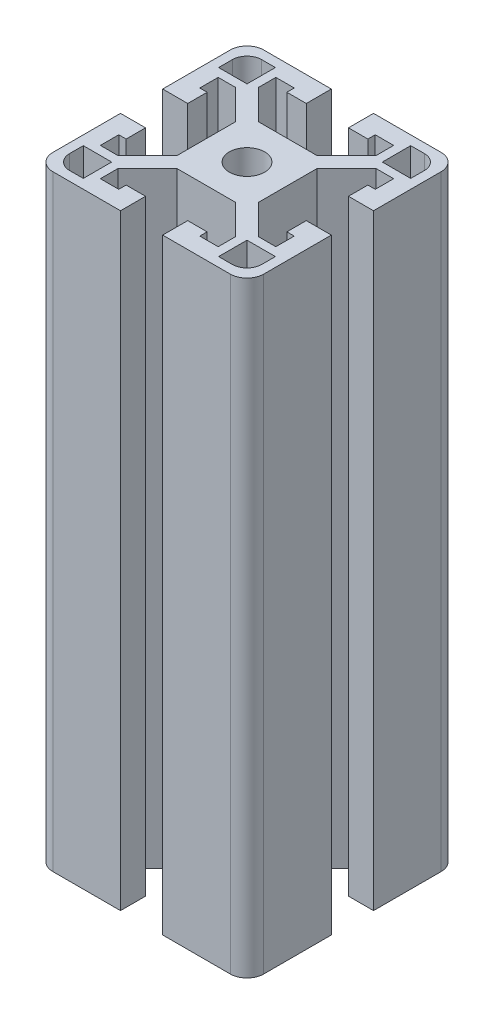
from build123d import *

# Parameters (mm, degrees)
SKETCH2_R                            = 3.35
F_40_SERIES_TS40_40LM_650033_2_DEPTH = 115
M8X1_25_TAPPED_HOLE3_D               = 6.8
M8X1_25_TAPPED_HOLE3_DEPTH           = 25
M8X1_25_TAPPED_HOLE3_TIP             = 2.042926105


with BuildPart() as part:
    # Sketch2 → 40 series TS40-40LM-650033(2) (new body)
    with BuildSketch(Plane(origin=(0, 0, 0), x_dir=(-1, 0, 0), z_dir=(0, 1, 0))):
        with BuildLine():
            Line((-7.7064, 0), (-7.7064, 5.551138531))
            Line((-7.7064, 5.551138531), (-13.331261469, 11.176))
            Line((-13.331261469, 11.176), (-16.6472, 11.176))
            Line((-16.6472, 11.176), (-16.6472, 7.6835))
            Line((-16.6472, 7.6835), (-15.2502, 7.6835))
            Line((-15.2502, 7.6835), (-15.2502, 4.0005))
            Line((-15.2502, 4.0005), (-20, 4.0005))
            Line((-20, 4.0005), (-20, 16.825))
            ThreePointArc((-20, 16.825), (-19.07006403, 19.07006403), (-16.825, 20))
            Line((-16.825, 20), (-4.0005, 20))
            Line((-4.0005, 20), (-4.0005, 15.2502))
            Line((-4.0005, 15.2502), (-7.6835, 15.2502))
            Line((-7.6835, 15.2502), (-7.6835, 16.6472))
            Line((-7.6835, 16.6472), (-11.176, 16.6472))
            Line((-11.176, 16.6472), (-11.176, 13.331261469))
            Line((-11.176, 13.331261469), (-5.551138531, 7.7064))
            Line((-5.551138531, 7.7064), (0, 7.7064))
            Line((0, 7.7064), (5.551138531, 7.7064))
            Line((5.551138531, 7.7064), (11.176, 13.331261469))
            Line((11.176, 13.331261469), (11.176, 16.6472))
            Line((11.176, 16.6472), (7.6835, 16.6472))
            Line((7.6835, 16.6472), (7.6835, 15.2502))
            Line((7.6835, 15.2502), (4.0005, 15.2502))
            Line((4.0005, 15.2502), (4.0005, 20))
            Line((4.0005, 20), (16.825, 20))
            ThreePointArc((16.825, 20), (19.07006403, 19.07006403), (20, 16.825))
            Line((20, 16.825), (20, 4.0005))
            Line((20, 4.0005), (15.2502, 4.0005))
            Line((15.2502, 4.0005), (15.2502, 7.6835))
            Line((15.2502, 7.6835), (16.6472, 7.6835))
            Line((16.6472, 7.6835), (16.6472, 11.176))
            Line((16.6472, 11.176), (13.331261469, 11.176))
            Line((13.331261469, 11.176), (7.7064, 5.551138531))
            Line((7.7064, 5.551138531), (7.7064, 0))
            Line((7.7064, 0), (7.7064, -5.551138531))
            Line((7.7064, -5.551138531), (13.331261469, -11.176))
            Line((13.331261469, -11.176), (16.6472, -11.176))
            Line((16.6472, -11.176), (16.6472, -7.6835))
            Line((16.6472, -7.6835), (15.2502, -7.6835))
            Line((15.2502, -7.6835), (15.2502, -4.0005))
            Line((15.2502, -4.0005), (20, -4.0005))
            Line((20, -4.0005), (20, -16.825))
            ThreePointArc((20, -16.825), (19.07006403, -19.07006403), (16.825, -20))
            Line((16.825, -20), (4.0005, -20))
            Line((4.0005, -20), (4.0005, -15.2502))
            Line((4.0005, -15.2502), (7.6835, -15.2502))
            Line((7.6835, -15.2502), (7.6835, -16.6472))
            Line((7.6835, -16.6472), (11.176, -16.6472))
            Line((11.176, -16.6472), (11.176, -13.331261469))
            Line((11.176, -13.331261469), (5.551138531, -7.7064))
            Line((5.551138531, -7.7064), (0, -7.7064))
            Line((0, -7.7064), (-5.551138531, -7.7064))
            Line((-5.551138531, -7.7064), (-11.176, -13.331261469))
            Line((-11.176, -13.331261469), (-11.176, -16.6472))
            Line((-11.176, -16.6472), (-7.6835, -16.6472))
            Line((-7.6835, -16.6472), (-7.6835, -15.2502))
            Line((-7.6835, -15.2502), (-4.0005, -15.2502))
            Line((-4.0005, -15.2502), (-4.0005, -20))
            Line((-4.0005, -20), (-16.825, -20))
            ThreePointArc((-16.825, -20), (-19.07006403, -19.07006403), (-20, -16.825))
            Line((-20, -16.825), (-20, -4.0005))
            Line((-20, -4.0005), (-15.2502, -4.0005))
            Line((-15.2502, -4.0005), (-15.2502, -7.6835))
            Line((-15.2502, -7.6835), (-16.6472, -7.6835))
            Line((-16.6472, -7.6835), (-16.6472, -11.176))
            Line((-16.6472, -11.176), (-13.331261469, -11.176))
            Line((-13.331261469, -11.176), (-7.7064, -5.551138531))
            Line((-7.7064, -5.551138531), (-7.7064, 0))
        make_face()
        Circle(SKETCH2_R, mode=Mode.SUBTRACT)
        with BuildLine():
            Line((18.222, 12.8372), (18.222, 15.428))
            ThreePointArc((18.222, 15.428), (17.403656347, 17.403656347), (15.428, 18.222))
            Line((15.428, 18.222), (12.8372, 18.222))
            Line((12.8372, 18.222), (12.8372, 12.8372))
            Line((12.8372, 12.8372), (18.222, 12.8372))
        make_face(mode=Mode.SUBTRACT)
        with BuildLine():
            Line((12.8372, -12.8372), (18.222, -12.8372))
            Line((18.222, -12.8372), (18.222, -15.428))
            ThreePointArc((18.222, -15.428), (17.403656347, -17.403656347), (15.428, -18.222))
            Line((15.428, -18.222), (12.8372, -18.222))
            Line((12.8372, -18.222), (12.8372, -12.8372))
        make_face(mode=Mode.SUBTRACT)
        with BuildLine():
            Line((-18.222, -12.8372), (-18.222, -15.428))
            ThreePointArc((-18.222, -15.428), (-17.403656347, -17.403656347), (-15.428, -18.222))
            Line((-15.428, -18.222), (-12.8372, -18.222))
            Line((-12.8372, -18.222), (-12.8372, -12.8372))
            Line((-12.8372, -12.8372), (-18.222, -12.8372))
        make_face(mode=Mode.SUBTRACT)
        with BuildLine():
            Line((-12.8372, 12.8372), (-18.222, 12.8372))
            Line((-18.222, 12.8372), (-18.222, 15.428))
            ThreePointArc((-18.222, 15.428), (-17.403656347, 17.403656347), (-15.428, 18.222))
            Line((-15.428, 18.222), (-12.8372, 18.222))
            Line((-12.8372, 18.222), (-12.8372, 12.8372))
        make_face(mode=Mode.SUBTRACT)
    extrude(amount=F_40_SERIES_TS40_40LM_650033_2_DEPTH)

    # M8x1.25 Tapped Hole3
    with Locations(Plane(origin=(0, 0, 0), x_dir=(-1, 0, 0), z_dir=(0, -1, 0))):
        with Locations((0, 0)):
            Hole(M8X1_25_TAPPED_HOLE3_D / 2, depth=M8X1_25_TAPPED_HOLE3_DEPTH)
            with Locations((0, 0, -(M8X1_25_TAPPED_HOLE3_DEPTH + M8X1_25_TAPPED_HOLE3_TIP / 2))):  # 118° drill point
                Cone(0, M8X1_25_TAPPED_HOLE3_D / 2, M8X1_25_TAPPED_HOLE3_TIP, mode=Mode.SUBTRACT)


solid = part.part
